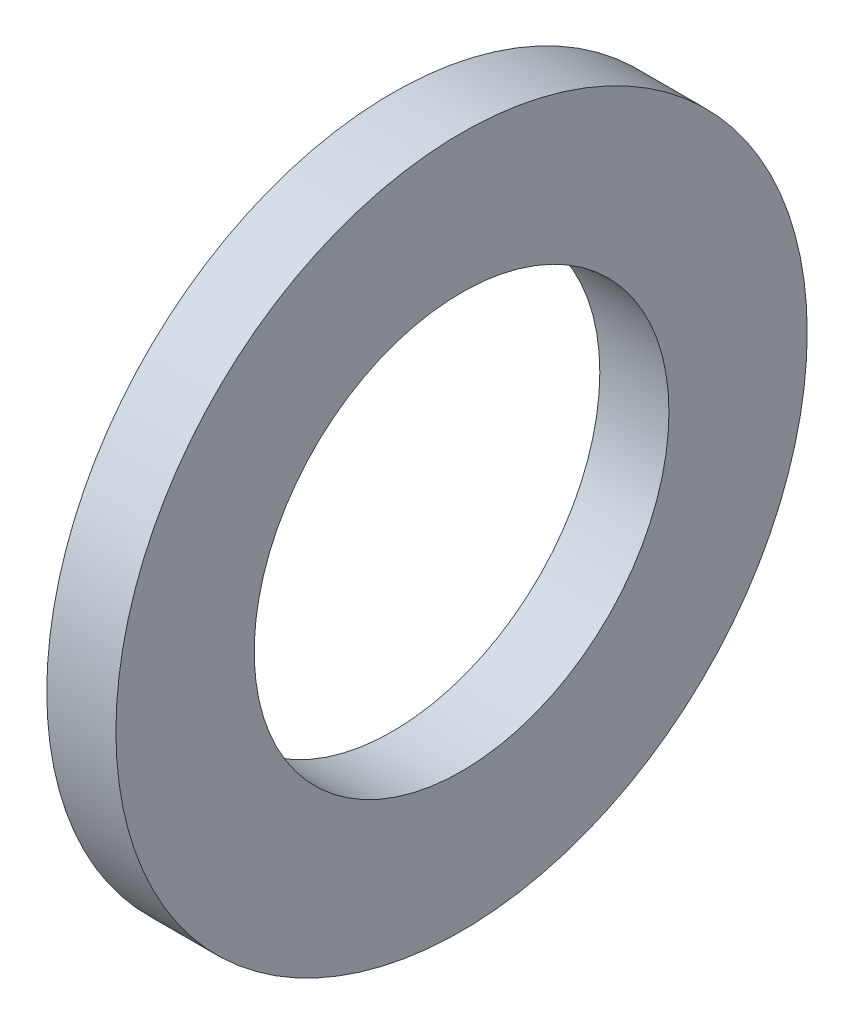
from build123d import *

# Parameters (mm, degrees)
SKETCH1_R           = 15.875
SKETCH1_R_2         = 9.525
BOSS_EXTRUDE1_DEPTH = 3.175


with BuildPart() as part:
    # Sketch1 → Boss-Extrude1 (new body)
    with BuildSketch(Plane(origin=(0, 0, 0), x_dir=(0, 0, -1), z_dir=(1, 0, 0))):
        Circle(SKETCH1_R)
        Circle(SKETCH1_R_2, mode=Mode.SUBTRACT)
    extrude(amount=BOSS_EXTRUDE1_DEPTH)


solid = part.part
